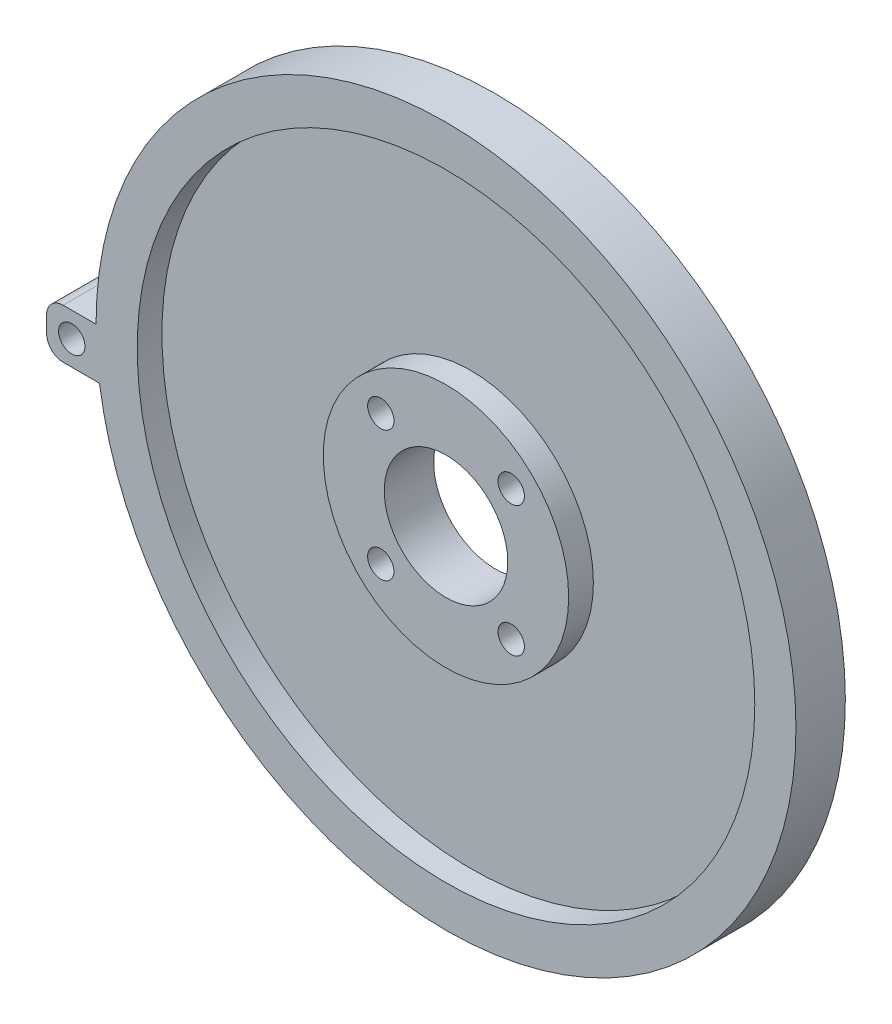
from build123d import *

# Parameters (mm, degrees)
SKETCH1_R                       = 42.5
SKETCH1_R_2                     = 1.6
SKETCH1_R_3                     = 7.5
BOSS_EXTRUDE1_DEPTH             = 3
SKETCH3_R                       = 42.5
SKETCH3_R_2                     = 37.5
SKETCH3_R_3                     = 14.9
SKETCH3_R_4                     = 1.6
SKETCH3_R_5                     = 7.5
BOSS_EXTRUDE2_DEPTH             = 3
BOSS_EXTRUDE3_REACH             = 308.999
SKETCH4_R                       = 1.6
BOSS_EXTRUDE3_DIRECTION_2_REACH = 308.999


with BuildPart() as part:
    # Sketch1 → Boss-Extrude1 (new body)
    with BuildSketch(Plane.XY):
        with Locations((260.117045421, -9.1)):
            Circle(SKETCH1_R)
        with Locations((252.197449472, -1.180404051)):
            Circle(SKETCH1_R_2, mode=Mode.SUBTRACT)
        with Locations((268.036641371, -1.180404051)):
            Circle(SKETCH1_R_2, mode=Mode.SUBTRACT)
        with Locations((252.197449472, -17.019595949)):
            Circle(SKETCH1_R_2, mode=Mode.SUBTRACT)
        with Locations((268.036641371, -17.019595949)):
            Circle(SKETCH1_R_2, mode=Mode.SUBTRACT)
        with Locations((260.117045421, -9.1)):
            Circle(SKETCH1_R_3, mode=Mode.SUBTRACT)
    extrude(amount=BOSS_EXTRUDE1_DEPTH)

    # Sketch3 → Boss-Extrude2 (add)
    # profile 1 of 2: a face of its own
    with BuildSketch(Plane.XY.offset(3)):
        with Locations((260.117045421, -9.1)):
            Circle(SKETCH3_R)
        with Locations((260.117045421, -9.1)):
            Circle(SKETCH3_R_2, mode=Mode.SUBTRACT)
    # profile 2 of 2: a face of its own
    with BuildSketch(Plane.XY.offset(3)):
        with Locations((260.117045421, -9.1)):
            Circle(SKETCH3_R_3)
        with Locations((252.197449472, -17.019595949)):
            Circle(SKETCH3_R_4, mode=Mode.SUBTRACT)
        with Locations((268.036641371, -1.180404051)):
            Circle(SKETCH3_R_4, mode=Mode.SUBTRACT)
        with Locations((268.036641371, -17.019595949)):
            Circle(SKETCH3_R_4, mode=Mode.SUBTRACT)
        with Locations((260.117045421, -9.1)):
            Circle(SKETCH3_R_5, mode=Mode.SUBTRACT)
        with Locations((252.197449472, -1.180404051)):
            Circle(SKETCH3_R_4, mode=Mode.SUBTRACT)
    extrude(amount=BOSS_EXTRUDE2_DEPTH)

    # Boss-Extrude3: up to this face of the body (flat: up to its plane)
    boss_extrude3_end = Plane(part.part.faces().sort_by_distance((218.819126949, -9.1, 6))[0])
    # Sketch4 → Boss-Extrude3 (add, up to the picked face)
    with BuildSketch(Plane.XY.offset(3), mode=Mode.PRIVATE) as boss_extrude3_sk1:
        with BuildLine():
            Line((217.617045421, -9.1), (213.617045421, -9.1))
            ThreePointArc((213.617045421, -9.1), (212.202831859, -9.685786438), (211.617045421, -11.1))
            Line((211.617045421, -11.1), (211.617045421, -13.1))
            ThreePointArc((211.617045421, -13.1), (212.202831859, -14.514213562), (213.617045421, -15.1))
            Line((213.617045421, -15.1), (218.042706448, -15.1))
            ThreePointArc((218.042706448, -15.1), (217.723594239, -12.107539996), (217.617045421, -9.1))
        make_face()
        with Locations((214.67031983, -12.103769998)):
            Circle(SKETCH4_R, mode=Mode.SUBTRACT)
    boss_extrude3_tool1 = split(extrude(boss_extrude3_sk1.sketch, amount=BOSS_EXTRUDE3_REACH, mode=Mode.PRIVATE), bisect_by=boss_extrude3_end, keep=Keep.BOTH, mode=Mode.PRIVATE)
    add(boss_extrude3_tool1.solids().sort_by(Axis((215.617045, -9.187914, 3), (0, 0, 1)))[0])

    # Boss-Extrude3 direction 2: up to this face of the body (flat: up to its plane)
    boss_extrude3_direction_2_end = Plane(part.part.faces().sort_by_distance((218.819126949, -9.1, 0))[0])
    # Sketch4 → Boss-Extrude3 direction 2 (add, up to the picked face)
    with BuildSketch(Plane.XY.offset(3), mode=Mode.PRIVATE) as boss_extrude3_direction_2_sk1:
        with BuildLine():
            Line((217.617045421, -9.1), (213.617045421, -9.1))
            ThreePointArc((213.617045421, -9.1), (212.202831859, -9.685786438), (211.617045421, -11.1))
            Line((211.617045421, -11.1), (211.617045421, -13.1))
            ThreePointArc((211.617045421, -13.1), (212.202831859, -14.514213562), (213.617045421, -15.1))
            Line((213.617045421, -15.1), (218.042706448, -15.1))
            ThreePointArc((218.042706448, -15.1), (217.723594239, -12.107539996), (217.617045421, -9.1))
        make_face()
        with Locations((214.67031983, -12.103769998)):
            Circle(SKETCH4_R, mode=Mode.SUBTRACT)
    boss_extrude3_direction_2_tool1 = split(extrude(boss_extrude3_direction_2_sk1.sketch, amount=-BOSS_EXTRUDE3_DIRECTION_2_REACH, mode=Mode.PRIVATE), bisect_by=boss_extrude3_direction_2_end, keep=Keep.BOTH, mode=Mode.PRIVATE)
    add(boss_extrude3_direction_2_tool1.solids().sort_by(Axis((215.617045, -9.187914, 3), (0, 0, -1)))[0])


solid = part.part
